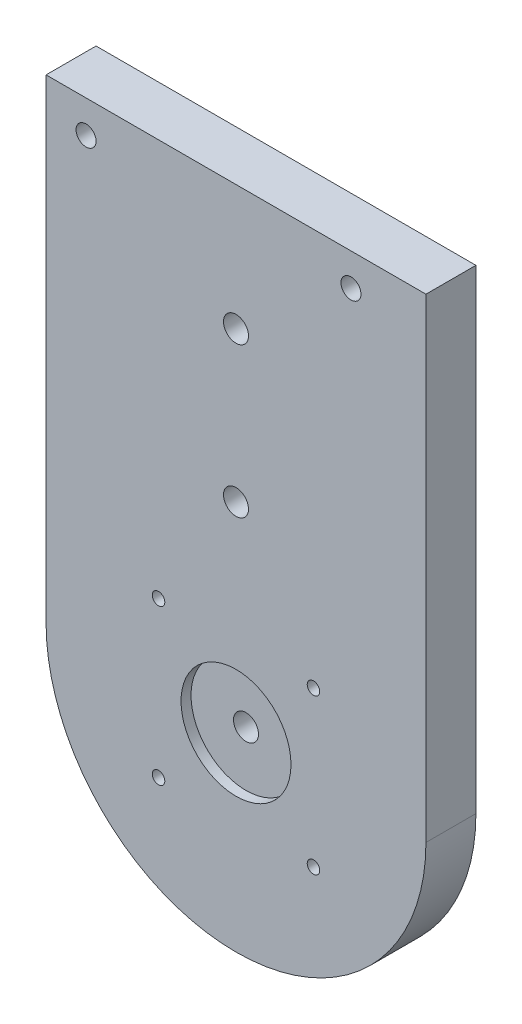
from build123d import *

# Parameters (mm, degrees)
CROQUIS1_R              = 2.5
CROQUIS1_R_2            = 1.25
SALIENTE_EXTRUIR1_DEPTH = 10
CROQUIS3_R              = 11
CORTAR_EXTRUIR1_DEPTH   = 2
CROQUIS4_R              = 2
CORTAR_EXTRUIR2_DEPTH   = 103.805641869


with BuildPart() as part:
    # Croquis1 → Saliente-Extruir1 (new body)
    with BuildSketch(Plane.XY):
        with BuildLine():
            Line((-38, 0), (-38, 95))
            Line((-38, 95), (38, 95))
            Line((38, 95), (38, 0))
            ThreePointArc((38, 0), (0, -38), (-38, 0))
        make_face()
        with Locations((0, 40)):
            Circle(CROQUIS1_R, mode=Mode.SUBTRACT)
        Circle(CROQUIS1_R, mode=Mode.SUBTRACT)
        with Locations((0, 70)):
            Circle(CROQUIS1_R, mode=Mode.SUBTRACT)
        with Locations((-15.5, 15.5)):
            Circle(CROQUIS1_R_2, mode=Mode.SUBTRACT)
        with Locations((15.5, 15.5)):
            Circle(CROQUIS1_R_2, mode=Mode.SUBTRACT)
        with Locations((15.5, -15.5)):
            Circle(CROQUIS1_R_2, mode=Mode.SUBTRACT)
        with Locations((-15.5, -15.5)):
            Circle(CROQUIS1_R_2, mode=Mode.SUBTRACT)
    extrude(amount=SALIENTE_EXTRUIR1_DEPTH)

    # Croquis3 → Cortar-Extruir1 (cut)
    with BuildSketch(Plane.XY.offset(10)):
        Circle(CROQUIS3_R)
    extrude(amount=-CORTAR_EXTRUIR1_DEPTH, mode=Mode.SUBTRACT)

    # Croquis4 → Cortar-Extruir2 (cut, through all)
    with BuildSketch(Plane.XY.offset(10)):
        with Locations((-30, 88.5)):
            Circle(CROQUIS4_R)
        with Locations((23, 88.5)):
            Circle(CROQUIS4_R)
    extrude(amount=-CORTAR_EXTRUIR2_DEPTH, mode=Mode.SUBTRACT)


solid = part.part
